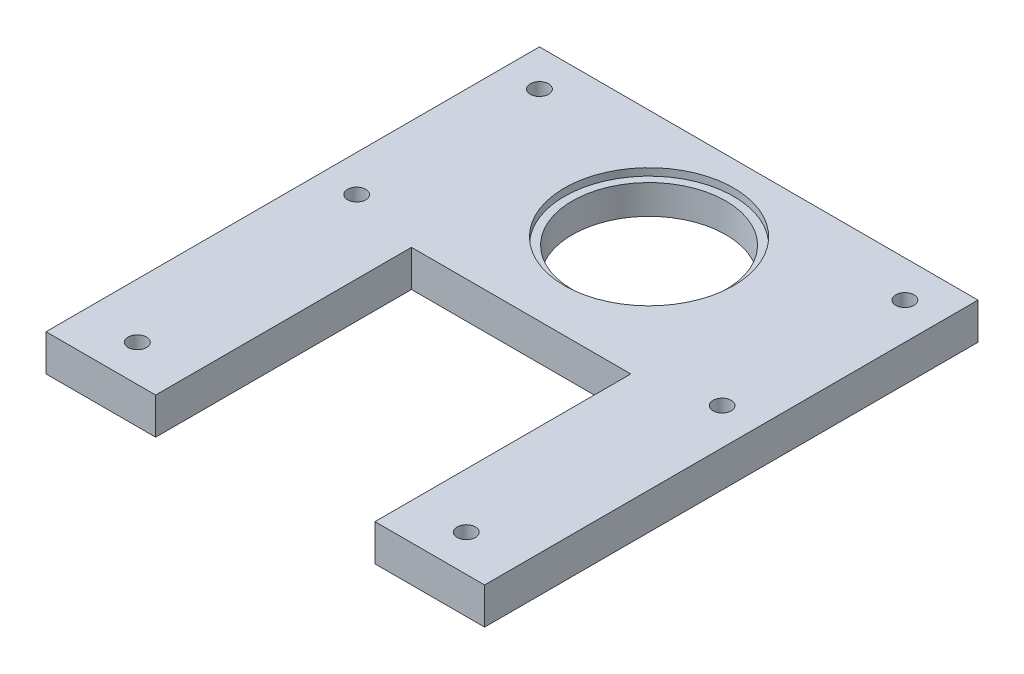
from build123d import *

# Parameters (mm, degrees)
SKETCH1_W               = 152.4
SKETCH1_H               = 171.45
BOSS_EXTRUDE1_DEPTH     = 12.7
CUT_EXTRUDE1_DEPTH      = 230.743666942
CUT_EXTRUDE1_DEPTH_BACK = 230.743666942
SKETCH2_R               = 26.67
CUT_EXTRUDE2_DEPTH      = 230.743666942
CUT_EXTRUDE2_DEPTH_BACK = 230.743666942
SKETCH3_R               = 3.175
SKETCH4_R               = 29.401540703
CUT_EXTRUDE3_DEPTH      = 2.54
CUT_EXTRUDE4_DEPTH      = 230.743666942
CUT_EXTRUDE4_DEPTH_BACK = 230.743666942
SKETCH5_W               = 76.2
SKETCH5_H               = 88.9
CUT_EXTRUDE5_DEPTH      = 230.743666942
CUT_EXTRUDE5_DEPTH_BACK = 230.743666942
SKETCH7_R               = 3.175


with BuildPart() as part:
    # Sketch1 → Boss-Extrude1 (new body)
    with BuildSketch(Plane(origin=(0, 0, 0), x_dir=(1, 0, 0), z_dir=(0, 1, 0))):
        with Locations((-76.2, 85.725)):
            Rectangle(SKETCH1_W, SKETCH1_H)
    extrude(amount=BOSS_EXTRUDE1_DEPTH)

    # Sketch2 → Cut-Extrude1 (cut, two sides: drawn at the far end of the back side and taken through both)
    with BuildSketch(Plane(origin=(0, 12.7, 0), x_dir=(1, 0, 0), z_dir=(0, 1, 0)).offset(-CUT_EXTRUDE1_DEPTH_BACK)):
        with Locations(Location((-76.2, 133.35, 0), (0, 0, 270))):
            Circle(SKETCH2_R)
    extrude(amount=CUT_EXTRUDE1_DEPTH + CUT_EXTRUDE1_DEPTH_BACK, mode=Mode.SUBTRACT)

    # Sketch3 → Cut-Extrude2 (cut, two sides: drawn at the far end of the back side and taken through both)
    with BuildSketch(Plane(origin=(0, 12.7, 0), x_dir=(1, 0, 0), z_dir=(0, 1, 0)).offset(-CUT_EXTRUDE2_DEPTH_BACK)):
        with Locations(Location((-139.7, 158.75, 0), (0, 0, 270))):
            Circle(SKETCH3_R)
        with Locations(Location((-12.7, 158.75, 0), (0, 0, 270))):
            Circle(SKETCH3_R)
        with Locations(Location((-12.7, 95.25, 0), (0, 0, 270))):
            Circle(SKETCH3_R)
        with Locations(Location((-139.7, 95.25, 0), (0, 0, 270))):
            Circle(SKETCH3_R)
    extrude(amount=CUT_EXTRUDE2_DEPTH + CUT_EXTRUDE2_DEPTH_BACK, mode=Mode.SUBTRACT)

    # Sketch4 → Cut-Extrude3 (cut)
    with BuildSketch(Plane(origin=(0, 12.7, 0), x_dir=(1, 0, 0), z_dir=(0, 1, 0))):
        with Locations(Location((-76.2, 133.35, 0), (0, 0, 270))):
            Circle(SKETCH4_R)
    extrude(amount=-CUT_EXTRUDE3_DEPTH, mode=Mode.SUBTRACT)

    # Sketch5 → Cut-Extrude4 (cut, two sides: drawn at the far end of the back side and taken through both)
    with BuildSketch(Plane.XZ.offset(-CUT_EXTRUDE4_DEPTH_BACK)):
        with Locations((-76.2, -44.45)):
            Rectangle(SKETCH5_W, SKETCH5_H)
    extrude(amount=CUT_EXTRUDE4_DEPTH + CUT_EXTRUDE4_DEPTH_BACK, mode=Mode.SUBTRACT)

    # Sketch7 → Cut-Extrude5 (cut, two sides: drawn at the far end of the back side and taken through both)
    with BuildSketch(Plane.XZ.offset(-CUT_EXTRUDE5_DEPTH_BACK)):
        with Locations(Location((-19.05, -12.7, 0), (0, 0, 270))):
            Circle(SKETCH7_R)
        with Locations(Location((-133.35, -12.7, 0), (0, 0, 270))):
            Circle(SKETCH7_R)
    extrude(amount=CUT_EXTRUDE5_DEPTH + CUT_EXTRUDE5_DEPTH_BACK, mode=Mode.SUBTRACT)


solid = part.part
